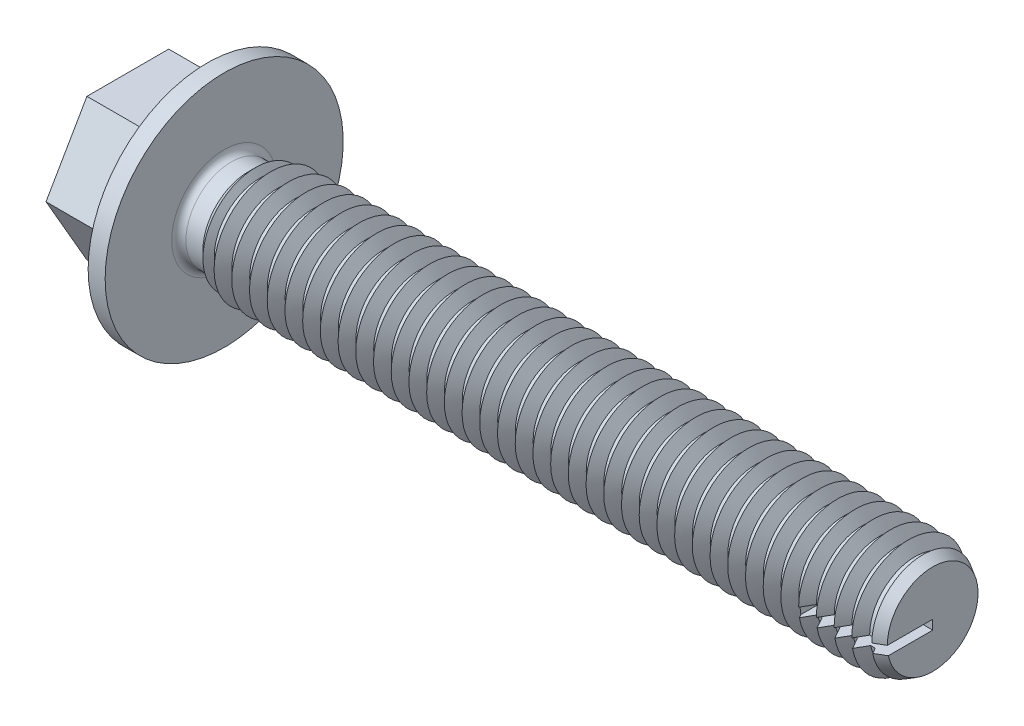
from build123d import *

# Parameters (mm, degrees)
EXTRUDE1_REACH           = 60.029
LPATTERN1_COUNT          = 38
LPATTERN1_PITCH          = 1.25
SKETCH11_W               = 5.6
SKETCH11_H               = 0.666666667
POINT_CUT_EXTRUDE8_DEPTH = 52.391828144
SKETCH16_R               = 4
CUT_EXTRUDE1_DEPTH       = 1.12


with BuildPart() as part:
    # Sketch1 → base-Revolve (revolve)
    with BuildSketch(Plane.XY, mode=Mode.PRIVATE) as base_revolve_sk:
        with BuildLine():
            Line((0, 8.4), (-1.2, 8.4))
            Line((-1.2, 8.4), (-2.304726967, 5))
            Line((-2.304726967, 5), (-6.8, 5))
            Line((-6.8, 5), (-6.8, 0))
            Line((-6.8, 0), (-5.68, 0))
            Line((-5.68, 0), (0, 0))
            Line((0, 0), (50, 0))
            Line((50, 0), (50, 4))
            Line((50, 4), (2.5, 4))
            Line((2.5, 4), (1.7, 3.2))
            Line((1.7, 3.2), (0.5, 3.2))
            ThreePointArc((0.5, 3.2), (0.146446609, 3.346446609), (0, 3.7))
            Line((0, 3.7), (0, 8.4))
        make_face()
    revolve(base_revolve_sk.sketch.rotate(Axis((0, 0, 0), (1, 0, 0)), 90), axis=Axis((0, 0, 0), (1, 0, 0)))

    # Extrude1: up to this cone (the profile starts outside it)
    extrude1_end = Plane(origin=(-6.8, 0, 0), z_dir=(1, 0, 0)).offset(2.870675552) * Cone(3.078e-06, 177.454079013, 57.658324448, align=(Align.CENTER, Align.CENTER, Align.MIN), mode=Mode.PRIVATE)
    # Sketch15 → Extrude1 (add, up to the surface)
    with BuildSketch(Plane.ZY.offset(6.8), mode=Mode.PRIVATE) as extrude1_sk1:
        Polygon((-2.886751346, 5), (-5.773502692, 0), (-2.886751346, -5), (2.886751346, -5), (5.773502692, 0), (2.886751346, 5), align=None)
    extrude1_tool1 = extrude(extrude1_sk1.sketch, amount=-EXTRUDE1_REACH, mode=Mode.PRIVATE) - extrude1_end
    add(extrude1_tool1.solids().sort_by_distance((-6.8, 0, 0))[0])

    # thd_Sketch7 → thd_Cut-Revolve2 (revolve, cut)
    with BuildSketch(Plane.XY, mode=Mode.PRIVATE) as thd_cut_revolve2_sk:
        Polygon((2.038119785, 4.923760431), (2.038119785, 4), (2.5, 3.2), (2.826239569, 3.2), (3.288119785, 4), (3.288119785, 4.923760431), (2.961880215, 4.923760431), align=None)
    thd_cut_revolve2 = revolve(thd_cut_revolve2_sk.sketch.rotate(Axis((0, 0, 0), (1, 0, 0)), 90), axis=Axis((0, 0, 0), (1, 0, 0)), mode=Mode.SUBTRACT)

    # LPattern1: thd_Cut-Revolve2 ×38
    with Locations(*[(i * LPATTERN1_PITCH, 0, 0) for i in range(1, LPATTERN1_COUNT)]):
        add(thd_cut_revolve2, mode=Mode.SUBTRACT)

    # Sketch8 → point_Cut-Revolve1 (revolve, cut)
    with BuildSketch(Plane.XY, mode=Mode.PRIVATE) as point_cut_revolve1_sk:
        Polygon((50, 0), (50.508, 0), (50.508, 4.508), (48.614359354, 4.508), (48.614359354, 4), (50, 3.2), align=None)
    revolve(point_cut_revolve1_sk.sketch.rotate(Axis((0, 0, 0), (1, 0, 0)), 90), axis=Axis((0, 0, 0), (1, 0, 0)), mode=Mode.SUBTRACT)

    # Sketch11 → point_Cut-Extrude8 (cut, through all)
    with BuildSketch(Plane.XY):
        with Locations((47.2, -0.333333333)):
            Rectangle(SKETCH11_W, SKETCH11_H)
    extrude(amount=POINT_CUT_EXTRUDE8_DEPTH, mode=Mode.SUBTRACT)

    # Sketch16 → Cut-Extrude1 (cut)
    with BuildSketch(Plane.ZY.offset(6.8)):
        Circle(SKETCH16_R)
    extrude(amount=-CUT_EXTRUDE1_DEPTH, mode=Mode.SUBTRACT)


solid = part.part
